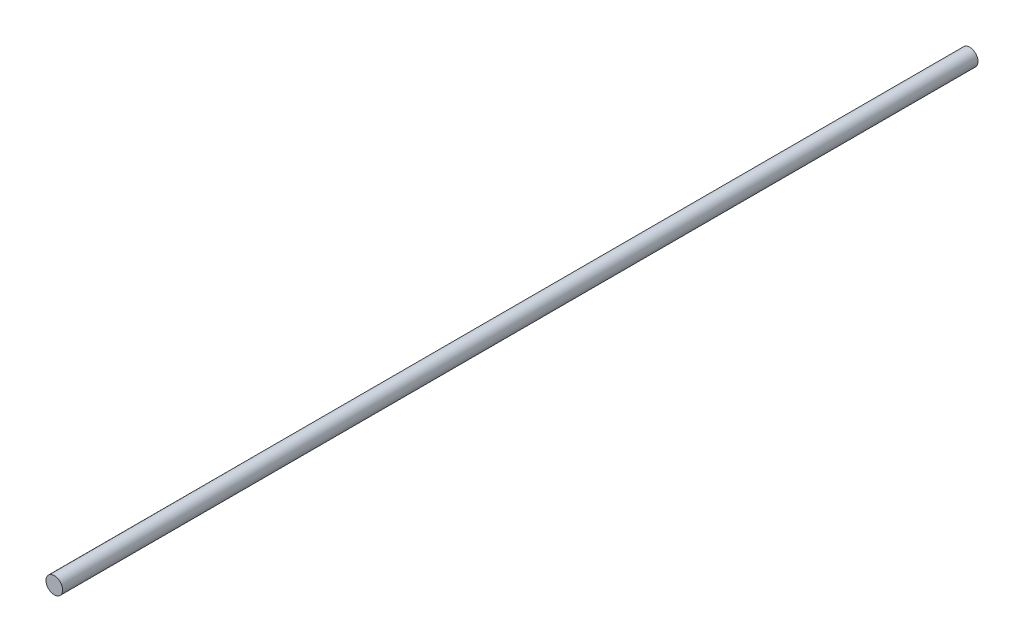
from build123d import *

# Parameters (mm, degrees)
ESQUISSE1_R        = 3
BOSS_EXTRU_1_DEPTH = 330


with BuildPart() as part:
    # Esquisse1 → Boss.-Extru.1 (new body)
    with BuildSketch(Plane.XY):
        Circle(ESQUISSE1_R)
    extrude(amount=BOSS_EXTRU_1_DEPTH)


solid = part.part
